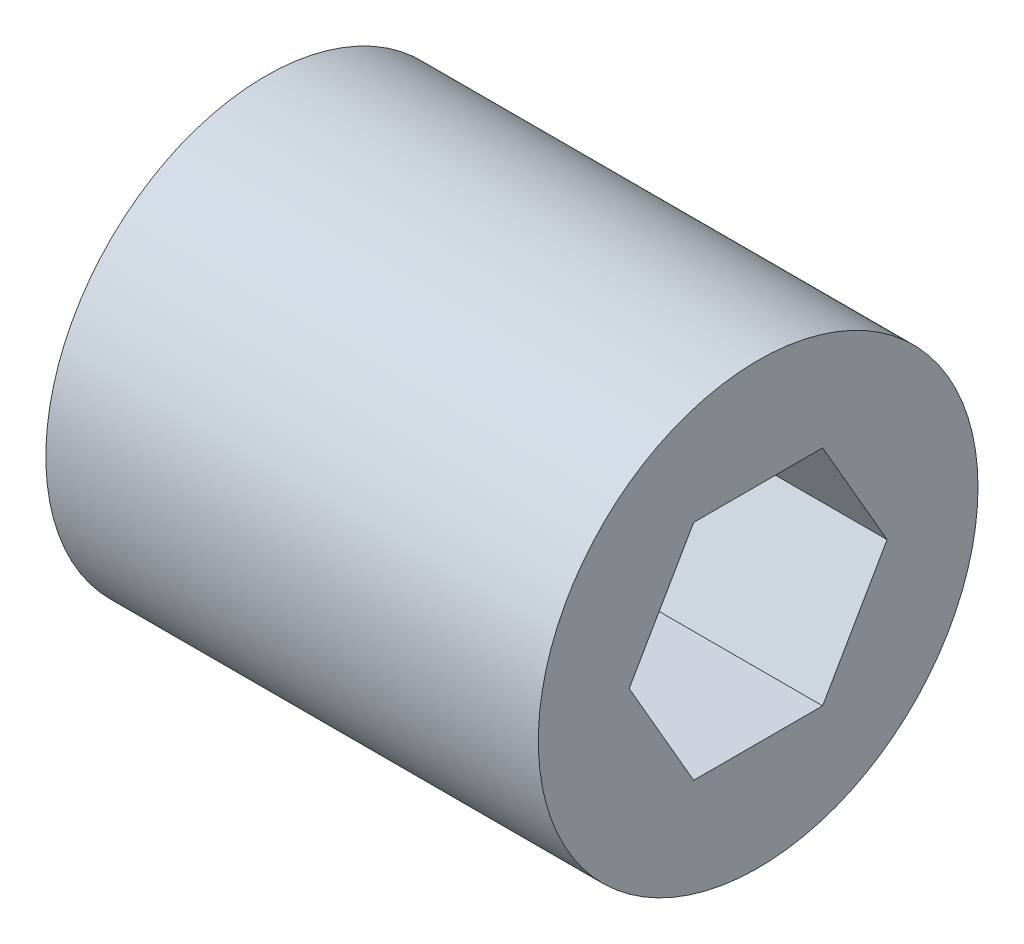
from build123d import *

# Parameters (mm, degrees)
CROQUIS1_R              = 12.5
SALIENTE_EXTRUIR1_DEPTH = 28


with BuildPart() as part:
    # Croquis1 → Saliente-Extruir1 (new body)
    with BuildSketch(Plane(origin=(0, 0, 0), x_dir=(0, 0, -1), z_dir=(1, 0, 0))):
        Circle(CROQUIS1_R)
        Polygon((7.332348419, 0), (3.666174209, 6.35), (-3.666174209, 6.35), (-7.332348419, 0), (-3.666174209, -6.35), (3.666174209, -6.35), align=None, mode=Mode.SUBTRACT)
    extrude(amount=SALIENTE_EXTRUIR1_DEPTH)


solid = part.part
